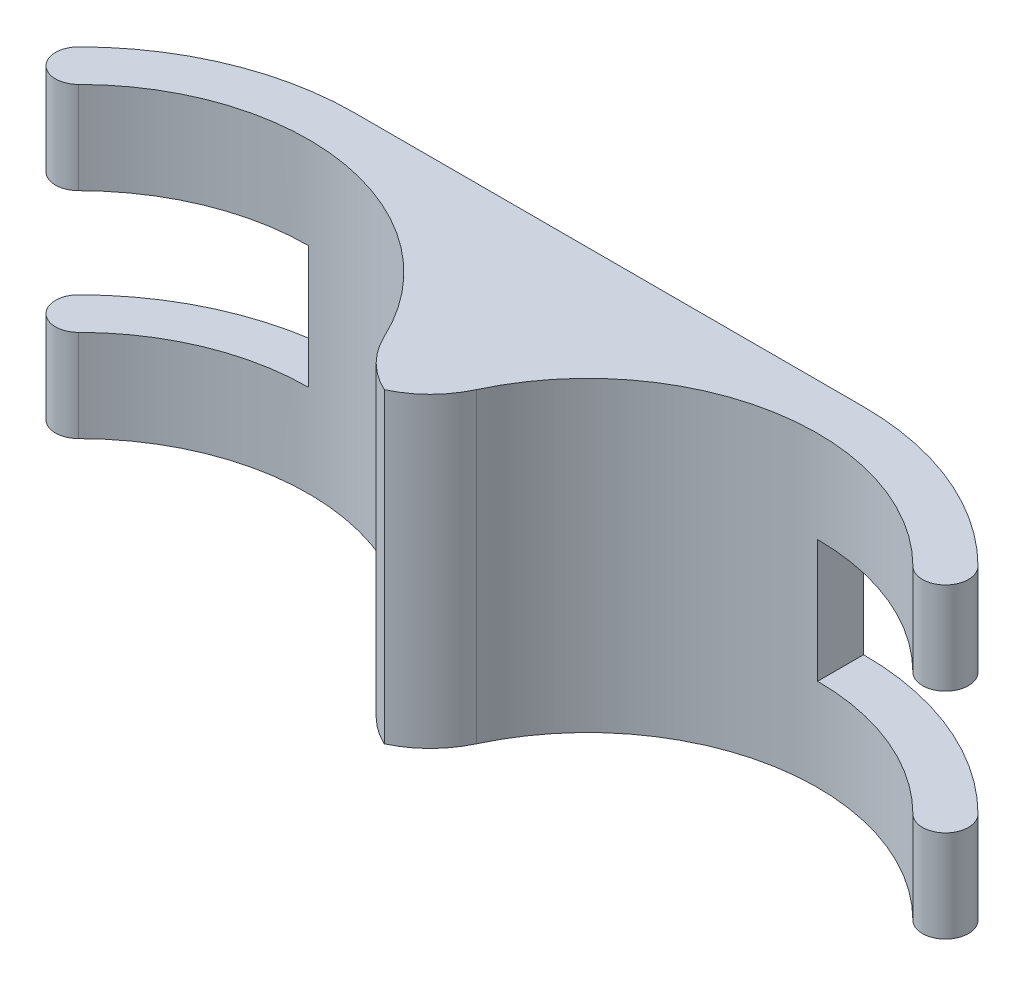
from build123d import *

# Parameters (mm, degrees)
BOSS_EXTRUDE2_DEPTH = 10
SKETCH2_W           = 6.583630945
SKETCH2_H           = 4
SKETCH2_W_2         = 6.583630944
CUT_EXTRUDE1_DEPTH  = 20


with BuildPart() as part:
    # Sketch1 → Boss-Extrude2 (new body)
    with BuildSketch(Plane(origin=(0, 0, 0), x_dir=(1, 0, 0), z_dir=(0, 1, 0))):
        with BuildLine():
            ThreePointArc((-9.797308403, 3.169636963), (-15.292255473, 7.386058148), (-21.897917664, 5.303300859))
            ThreePointArc((-21.897917664, 5.303300859), (-22.958577836, 5.303300859), (-22.958577836, 6.363961031))
            ThreePointArc((-22.958577836, 6.363961031), (-20.038767697, 8.314915793), (-16.594616806, 9))
            Line((-16.594616806, 9), (0, 9))
            ThreePointArc((0, 9), (3.444150891, 8.314915793), (6.363961031, 6.363961031))
            ThreePointArc((6.363961031, 6.363961031), (6.363961031, 5.303300859), (5.303300859, 5.303300859))
            ThreePointArc((5.303300859, 5.303300859), (-1.302361333, 7.386058148), (-6.797308403, 3.169636963))
            ThreePointArc((-6.797308403, 3.169636963), (-7.415063167, 2.287391728), (-8.297308403, 1.669636963))
            ThreePointArc((-8.297308403, 1.669636963), (-9.179553638, 2.287391728), (-9.797308403, 3.169636963))
        make_face()
    extrude(amount=BOSS_EXTRUDE2_DEPTH)

    # Sketch2 → Cut-Extrude1 (cut)
    with BuildSketch(Plane(origin=(0, 0, -9), x_dir=(-1, 0, 0), z_dir=(0, 0, -1))):
        with Locations((-3.291815473, 5)):
            Rectangle(SKETCH2_W, SKETCH2_H)
        with Locations((19.886432278, 5)):
            Rectangle(SKETCH2_W_2, SKETCH2_H)
    extrude(amount=-CUT_EXTRUDE1_DEPTH, mode=Mode.SUBTRACT)


solid = part.part
